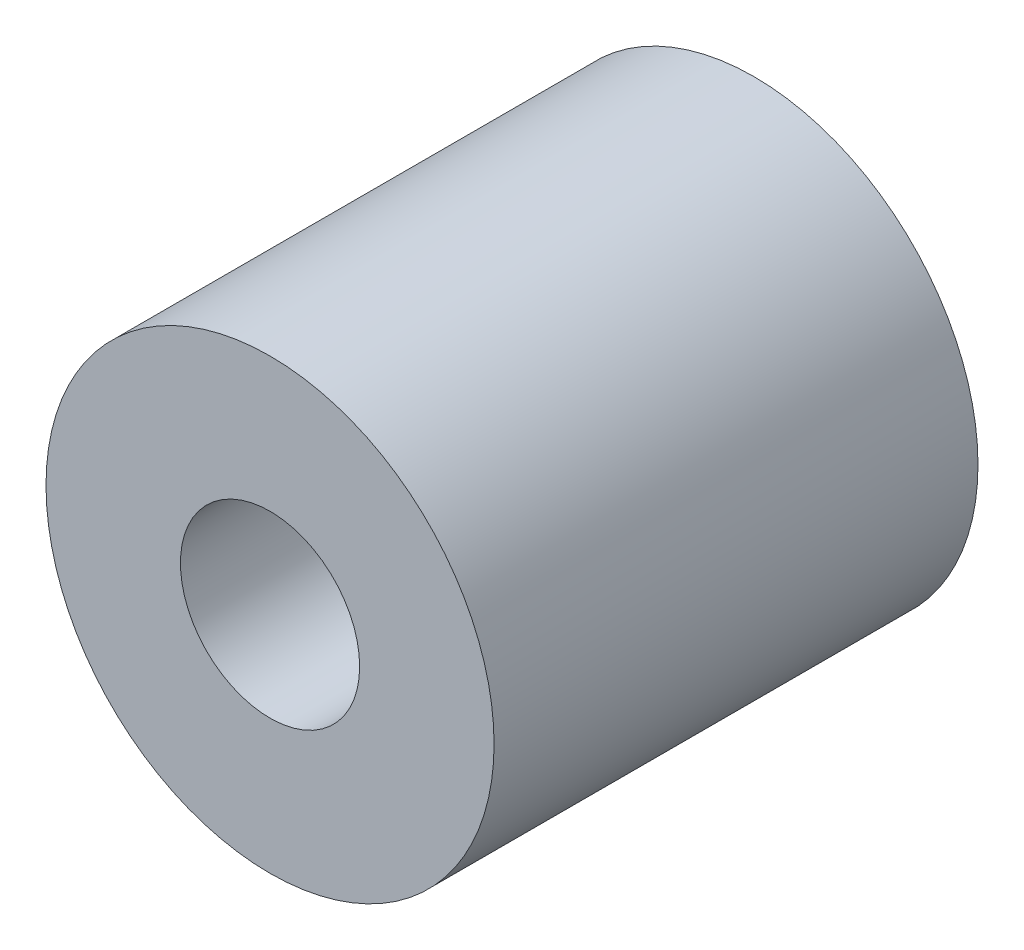
from build123d import *

# Parameters (mm, degrees)
SKETCH1_R           = 3.175
SKETCH1_R_2         = 1.27
BOSS_EXTRUDE1_DEPTH = 6.858


with BuildPart() as part:
    # Sketch1 → Boss-Extrude1 (new body)
    with BuildSketch(Plane.XY):
        Circle(SKETCH1_R)
        Circle(SKETCH1_R_2, mode=Mode.SUBTRACT)
    extrude(amount=BOSS_EXTRUDE1_DEPTH)


solid = part.part
